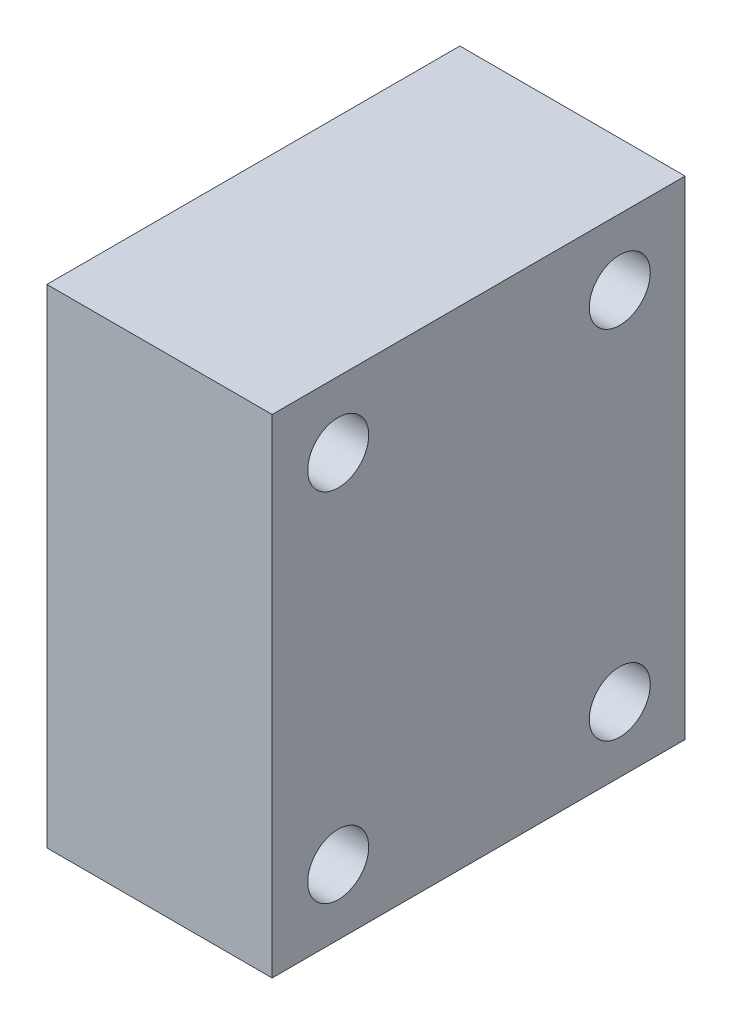
from build123d import *

# Parameters (mm, degrees)
SKETCH1_W           = 82.55
SKETCH1_H           = 69.85
BOSS_EXTRUDE1_DEPTH = 38.1
SKETCH2_R           = 5.159375
CUT_EXTRUDE2_DEPTH  = 115.652235041
SKETCH3_R           = 7.3421875
CUT_EXTRUDE3_DEPTH  = 28.448
SKETCH4_R           = 12.7254
CUT_EXTRUDE4_DEPTH  = 2.8194
SKETCH6_R           = 12.7254
CUT_EXTRUDE7_DEPTH  = 2.8194


with BuildPart() as part:
    # Sketch1 → Boss-Extrude1 (new body)
    with BuildSketch(Plane.YZ):
        with Locations((41.275, 34.925)):
            Rectangle(SKETCH1_W, SKETCH1_H)
    extrude(amount=BOSS_EXTRUDE1_DEPTH)

    # Sketch2 → Cut-Extrude2 (cut, through all)
    with BuildSketch(Plane.YZ):
        with Locations(Location((11.049, 11.049, 0), (0, 0, 270))):
            Circle(SKETCH2_R)
        with Locations(Location((71.374, 11.049, 0), (0, 0, 270))):
            Circle(SKETCH2_R)
        with Locations(Location((11.049, 58.674, 0), (0, 0, 270))):
            Circle(SKETCH2_R)
        with Locations(Location((71.374, 58.674, 0), (0, 0, 270))):
            Circle(SKETCH2_R)
    extrude(amount=CUT_EXTRUDE2_DEPTH, mode=Mode.SUBTRACT)

    # Sketch3 → Cut-Extrude3 (cut)
    with BuildSketch(Plane.YZ):
        with Locations(Location((23.622, 34.798, 0), (0, 0, 270))):
            Circle(SKETCH3_R)
        with Locations(Location((58.674, 34.798, 0), (0, 0, 270))):
            Circle(SKETCH3_R)
    extrude(amount=CUT_EXTRUDE3_DEPTH, mode=Mode.SUBTRACT)

    # Sketch4 → Cut-Extrude4 (cut)
    with BuildSketch(Plane.YZ):
        with Locations(Location((23.622, 34.798, 0), (0, 0, 270))):
            Circle(SKETCH4_R)
        with Locations(Location((58.674, 34.798, 0), (0, 0, 270))):
            Circle(SKETCH4_R)
    extrude(amount=CUT_EXTRUDE4_DEPTH, mode=Mode.SUBTRACT)

    # Sketch6 → Cut-Extrude7 (cut)
    with BuildSketch(Plane.YZ):
        with Locations((0, 41.275)):
            Circle(SKETCH6_R)
    extrude(amount=CUT_EXTRUDE7_DEPTH, mode=Mode.SUBTRACT)


solid = part.part
